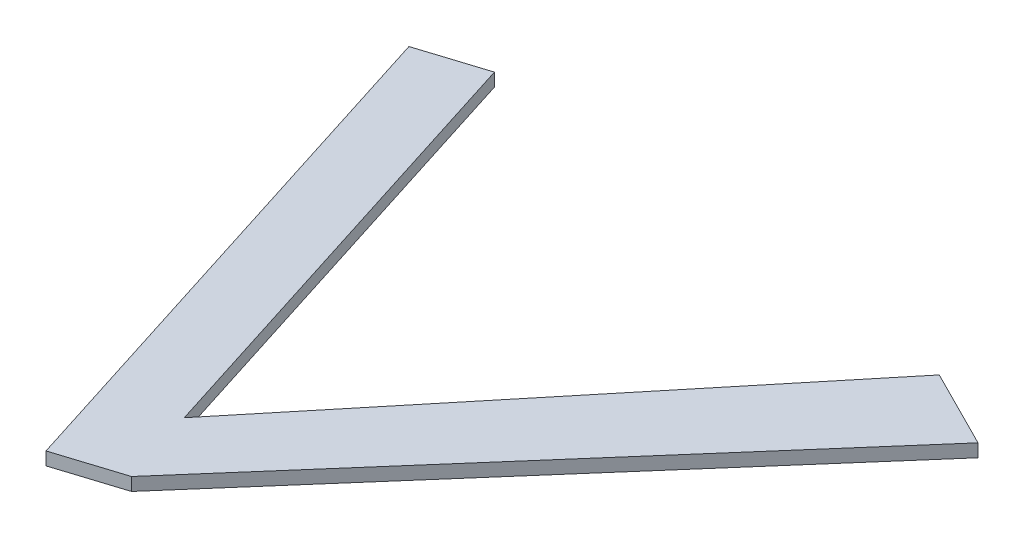
from build123d import *

# Parameters (mm, degrees)
BOSS_EXTRUDE1_DEPTH = 1


with BuildPart() as part:
    # Sketch1 → Boss-Extrude1 (new body)
    with BuildSketch(Plane(origin=(0, 0, 0), x_dir=(1, 0, 0), z_dir=(0, 1, 0))):
        Polygon((0, 0), (-11.117335152, 35.028093855), (-16.12134856, 33.439903119), (-3.113310151, -7.545349555), (1.890703257, -5.957158819), (32.26857299, 28.917581761), (26.241325106, 31.956460328), align=None)
    extrude(amount=BOSS_EXTRUDE1_DEPTH)


solid = part.part
